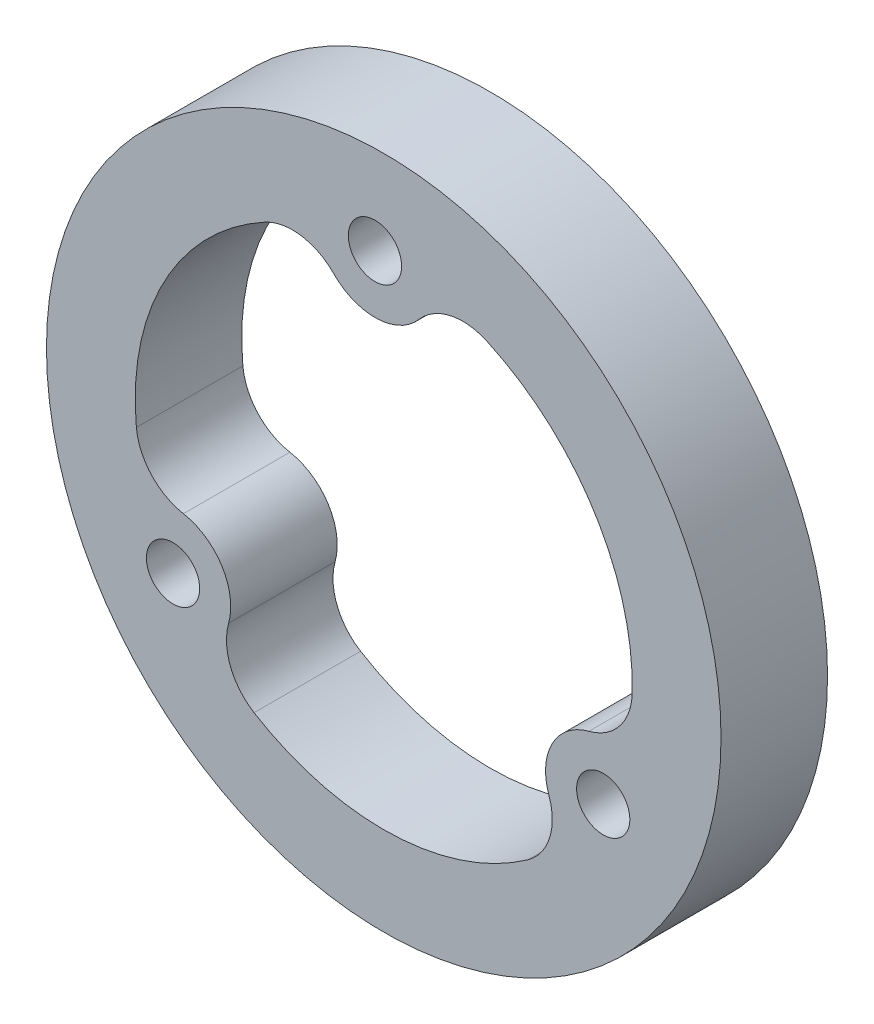
from build123d import *

# Parameters (mm, degrees)
ESQUISSE1_R        = 19
ESQUISSE1_R_2      = 1.5
BOSS_EXTRU_2_DEPTH = 6


with BuildPart() as part:
    # Esquisse1 → Boss.-Extru.2 (new body)
    with BuildSketch(Plane.XY):
        Circle(ESQUISSE1_R)
        with Locations((-0.493805045, 13.991288596)):
            Circle(ESQUISSE1_R_2, mode=Mode.SUBTRACT)
        with Locations((12.363713879, -6.567996584)):
            Circle(ESQUISSE1_R_2, mode=Mode.SUBTRACT)
        with Locations((-11.869908833, -7.423292012)):
            Circle(ESQUISSE1_R_2, mode=Mode.SUBTRACT)
        with BuildLine():
            ThreePointArc((-2.815595301, 11.717131607), (-0.379171731, 10.743310886), (1.982535482, 11.886475637))
            ThreePointArc((1.982535482, 11.886475637), (3.751818189, 12.953817976), (5.806908291, 12.738909534))
            ThreePointArc((5.806908291, 12.738909534), (11.869908833, 7.423292012), (13.995505264, -0.354728625))
            ThreePointArc((13.995505264, -0.354728625), (13.289218046, -2.296567787), (11.555131282, -3.420188746))
            ThreePointArc((11.555131282, -3.420188746), (9.493566014, -5.043283091), (9.302722122, -7.66016391))
            ThreePointArc((9.302722122, -7.66016391), (9.342426349, -9.72607885), (8.128765127, -11.398384864))
            ThreePointArc((8.128765127, -11.398384864), (0.493805045, -13.991288596), (-7.304956633, -11.943098785))
            ThreePointArc((-7.304956633, -11.943098785), (-8.633495068, -10.360516531), (-8.739535981, -8.296942861))
            ThreePointArc((-8.739535981, -8.296942861), (-9.114394283, -5.700027795), (-11.285257604, -4.226311727))
            ThreePointArc((-11.285257604, -4.226311727), (-13.094244538, -3.227739126), (-13.935673418, -1.34052467))
            ThreePointArc((-13.935673418, -1.34052467), (-12.363713879, 6.567996584), (-6.690548632, 12.29782741))
            ThreePointArc((-6.690548632, 12.29782741), (-4.655722978, 12.657084318), (-2.815595301, 11.717131607))
        make_face(mode=Mode.SUBTRACT)
    extrude(amount=BOSS_EXTRU_2_DEPTH)


solid = part.part
